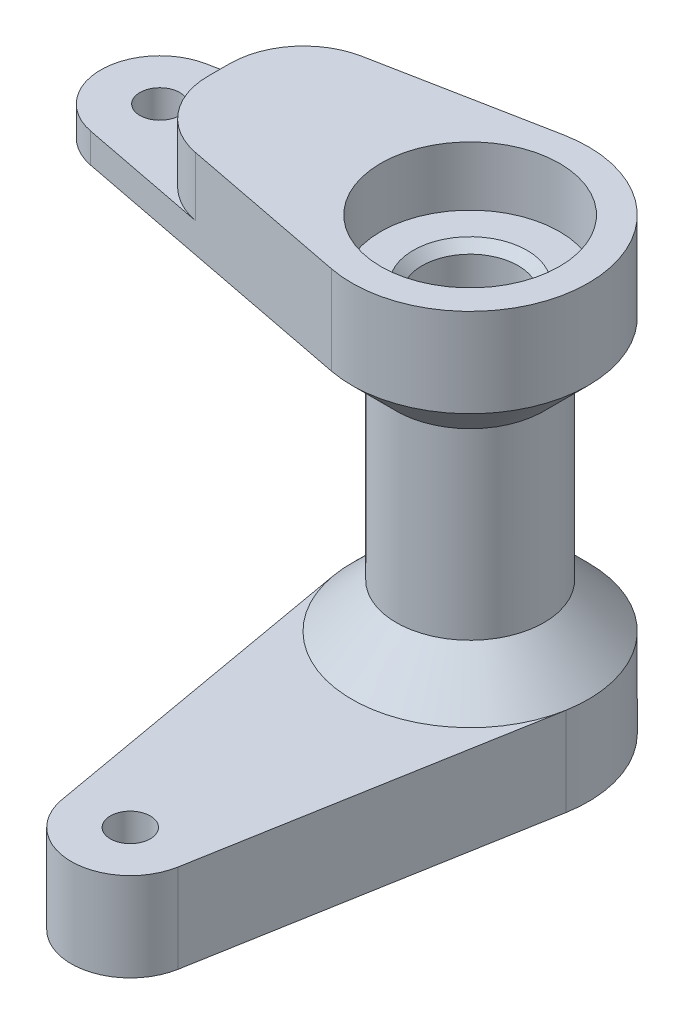
from build123d import *

# Parameters (mm, degrees)
ESQUISSE2_R                         = 1.35
BOSS_EXTRU_2_DEPTH                  = 6
BOSS_EXTRU_3_START                  = -6
ESQUISSE3_R                         = 1.35
BOSS_EXTRU_3_DEPTH                  = 6
ENL_V_MAT_EXTRU_1_REACH             = 49.73
ESQUISSE4_W                         = 8
ESQUISSE4_H                         = 4
ENL_V_MAT_EXTRU_1_DIRECTION_2_REACH = 49.73
CONG_1_R                            = 5


with BuildPart() as part:
    # Esquisse1 → Révolution1 (revolve)
    with BuildSketch(Plane.XY, mode=Mode.PRIVATE) as r_volution1_sk:
        Polygon((-6.05, 0), (-6.05, 4), (-3.85, 4), (-3.25, 4.6), (-3.25, 25.8), (-3.85, 26.4), (-6.05, 26.4), (-6.05, 30.4), (-8, 30.4), (-8, 24.4), (-5, 21.4), (-5, 9), (-8, 6), (-8, 0), align=None)
    revolve(r_volution1_sk.sketch.rotate(Axis((0, -1.144220684, 0), (0, 1, 0)), 270), axis=Axis((0, -1.144220684, 0), (0, 1, 0)))

    # Esquisse2 → Boss.-Extru.2 (add)
    with BuildSketch(Plane(origin=(0, 0, 0), x_dir=(1, 0, 0), z_dir=(0, 1, 0))):
        with BuildLine():
            Line((-7.878088106, -1.391304348), (-3.939044053, -23.695652174))
            ThreePointArc((-3.939044053, -23.695652174), (0, -27), (3.939044053, -23.695652174))
            Line((3.939044053, -23.695652174), (7.878088106, -1.391304348))
            ThreePointArc((7.878088106, -1.391304348), (0, -8), (-7.878088106, -1.391304348))
        make_face()
        with Locations(Location((0, -23, 0), (0, 0, 270))):
            Circle(ESQUISSE2_R, mode=Mode.SUBTRACT)
    extrude(amount=BOSS_EXTRU_2_DEPTH)

    # Esquisse3 → Boss.-Extru.3 (add)
    with BuildSketch(Plane(origin=(0, 30.4, 0), x_dir=(1, 0, 0), z_dir=(0, 1, 0)).offset(BOSS_EXTRU_3_START)):
        with BuildLine():
            Line((-21.761904762, -3.926767262), (-1.523809524, -7.853534525))
            ThreePointArc((-1.523809524, -7.853534525), (-8, 0), (-1.523809524, 7.853534525))
            Line((-1.523809524, 7.853534525), (-21.761904762, 3.926767262))
            ThreePointArc((-21.761904762, 3.926767262), (-25, 0), (-21.761904762, -3.926767262))
        make_face()
        with Locations(Location((-21, 0, 0), (0, 0, 270))):
            Circle(ESQUISSE3_R, mode=Mode.SUBTRACT)
    extrude(amount=BOSS_EXTRU_3_DEPTH)

    # Enlèv. mat.-Extru.1: up to this plane
    enl_v_mat_extru_1_end = Plane(origin=(-21.761904762, 24.4, -3.926767262), z_dir=(-0.19047619047618092, 0, -0.9816918156232545))
    # Esquisse4 → Enlèv. mat.-Extru.1 (cut, up to the surface)
    with BuildSketch(Plane.XY, mode=Mode.PRIVATE) as enl_v_mat_extru_1_sk1:
        with Locations((-21, 28.4)):
            Rectangle(ESQUISSE4_W, ESQUISSE4_H)
    enl_v_mat_extru_1_tool1 = split(extrude(enl_v_mat_extru_1_sk1.sketch, amount=-ENL_V_MAT_EXTRU_1_REACH, mode=Mode.PRIVATE), bisect_by=enl_v_mat_extru_1_end, keep=Keep.BOTH, mode=Mode.PRIVATE)
    add(enl_v_mat_extru_1_tool1.solids().sort_by_distance((-21, 28.4, 0))[0], mode=Mode.SUBTRACT)

    # Enlèv. mat.-Extru.1 direction 2: up to this plane
    enl_v_mat_extru_1_direction_2_end = Plane(origin=(-21.761904762, 24.4, 3.926767262), z_dir=(-0.19047619047620132, 0, 0.9816918156232504))
    # Esquisse4 → Enlèv. mat.-Extru.1 direction 2 (cut, up to the surface)
    with BuildSketch(Plane.XY, mode=Mode.PRIVATE) as enl_v_mat_extru_1_direction_2_sk1:
        with Locations((-21, 28.4)):
            Rectangle(ESQUISSE4_W, ESQUISSE4_H)
    enl_v_mat_extru_1_direction_2_tool1 = split(extrude(enl_v_mat_extru_1_direction_2_sk1.sketch, amount=ENL_V_MAT_EXTRU_1_DIRECTION_2_REACH, mode=Mode.PRIVATE), bisect_by=enl_v_mat_extru_1_direction_2_end, keep=Keep.BOTH, mode=Mode.PRIVATE)
    add(enl_v_mat_extru_1_direction_2_tool1.solids().sort_by_distance((-21, 28.4, 0))[0], mode=Mode.SUBTRACT)

    # Congé1
    cong_1_edges = [part.edges().sort_by_distance(p)[0] for p in [
        (-17, 28.4, -4.850712501),
        (-17, 28.4, 4.850712501),
    ]]
    fillet(cong_1_edges, radius=CONG_1_R)


solid = part.part
